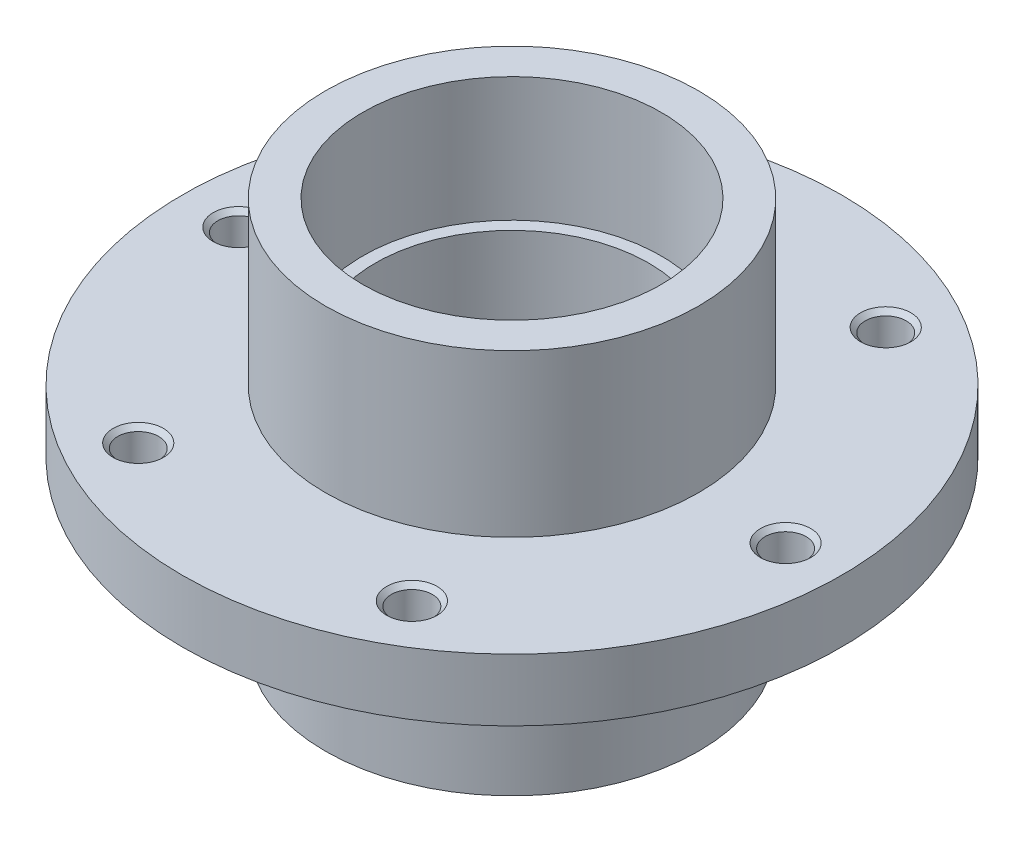
from build123d import *

# Parameters (mm, degrees)
SKETCH_1_R                   = 26.5
EXTRUDE_2_DEPTH              = 5
SKETCH_3_R                   = 15
EXTRUDE_3_DEPTH              = 13
EXTRUDE_START                = 13
SKETCH_4_R                   = 15
EXTRUDE_4_DEPTH              = 13
HOLE_WIZARD_M4_1_D           = 3.3
HOLE_WIZARD_M4_1_CSINK_D     = 4.05
HOLE_WIZARD_M4_1_CSINK_ANGLE = 90
PATTERN_CIRCULAR_1_COUNT     = 6
SKETCH_7_R                   = 11
CUT_EXTRUDE_1_DEPTH          = 31
SKETCH_8_R                   = 12
CUT_EXTRUDE_2_DEPTH          = 10


with BuildPart() as part:
    # 草图1 → 凸台-拉伸2 (new body)
    with BuildSketch(Plane(origin=(0, 0, 0), x_dir=(1, 0, 0), z_dir=(0, 1, 0))):
        with Locations(Location((0, 0, 0), (0, 0, 270))):
            Circle(SKETCH_1_R)
    extrude(amount=EXTRUDE_2_DEPTH)

    # 草图3 → 凸台-拉伸3 (add)
    with BuildSketch(Plane(origin=(0, 5, 0), x_dir=(1, 0, 0), z_dir=(0, 1, 0))):
        with Locations(Location((0, 0, 0), (0, 0, 90))):
            Circle(SKETCH_3_R)
    extrude(amount=EXTRUDE_3_DEPTH)

    # 草图4 → 凸台-拉伸4 (add)
    with BuildSketch(Plane.XZ.offset(EXTRUDE_START)):
        with Locations(Location((0, 0, 0), (0, 0, 270))):
            Circle(SKETCH_4_R)
    extrude(amount=-EXTRUDE_4_DEPTH)

    # M4 螺纹孔1 (through all)
    with Locations(Plane(origin=(22, 5, 0), x_dir=(0, 0, 1), z_dir=(0, 1, 0))):
        with Locations((0, 0)):
            hole_wizard_m4_1 = CounterSinkHole(HOLE_WIZARD_M4_1_D / 2, HOLE_WIZARD_M4_1_CSINK_D / 2, counter_sink_angle=HOLE_WIZARD_M4_1_CSINK_ANGLE)

    # 阵列(圆周)1: M4 螺纹孔1 ×6 about axis
    pattern_circular_1_axis = Axis((0, 0, 0), (0, 1, 0))
    for i in range(1, PATTERN_CIRCULAR_1_COUNT):
        add(hole_wizard_m4_1.rotate(pattern_circular_1_axis, i * 360 / PATTERN_CIRCULAR_1_COUNT), mode=Mode.SUBTRACT)

    # 草图7 → 切除-拉伸1 (cut)
    with BuildSketch(Plane(origin=(0, 18, 0), x_dir=(1, 0, 0), z_dir=(0, 1, 0))):
        with Locations(Location((0, 0, 0), (0, 0, 270))):
            Circle(SKETCH_7_R)
    extrude(amount=-CUT_EXTRUDE_1_DEPTH, mode=Mode.SUBTRACT)

    # 草图8 → 切除-拉伸2 (cut)
    with BuildSketch(Plane(origin=(0, 18, 0), x_dir=(1, 0, 0), z_dir=(0, 1, 0))):
        with Locations(Location((0, 0, 0), (0, 0, 270))):
            Circle(SKETCH_8_R)
    cut_extrude_2 = extrude(amount=-CUT_EXTRUDE_2_DEPTH, mode=Mode.SUBTRACT)

    # 镜向1: 切除-拉伸2 across plane
    add(cut_extrude_2.mirror(Plane.ZX.offset(2.5)), mode=Mode.SUBTRACT)


solid = part.part
